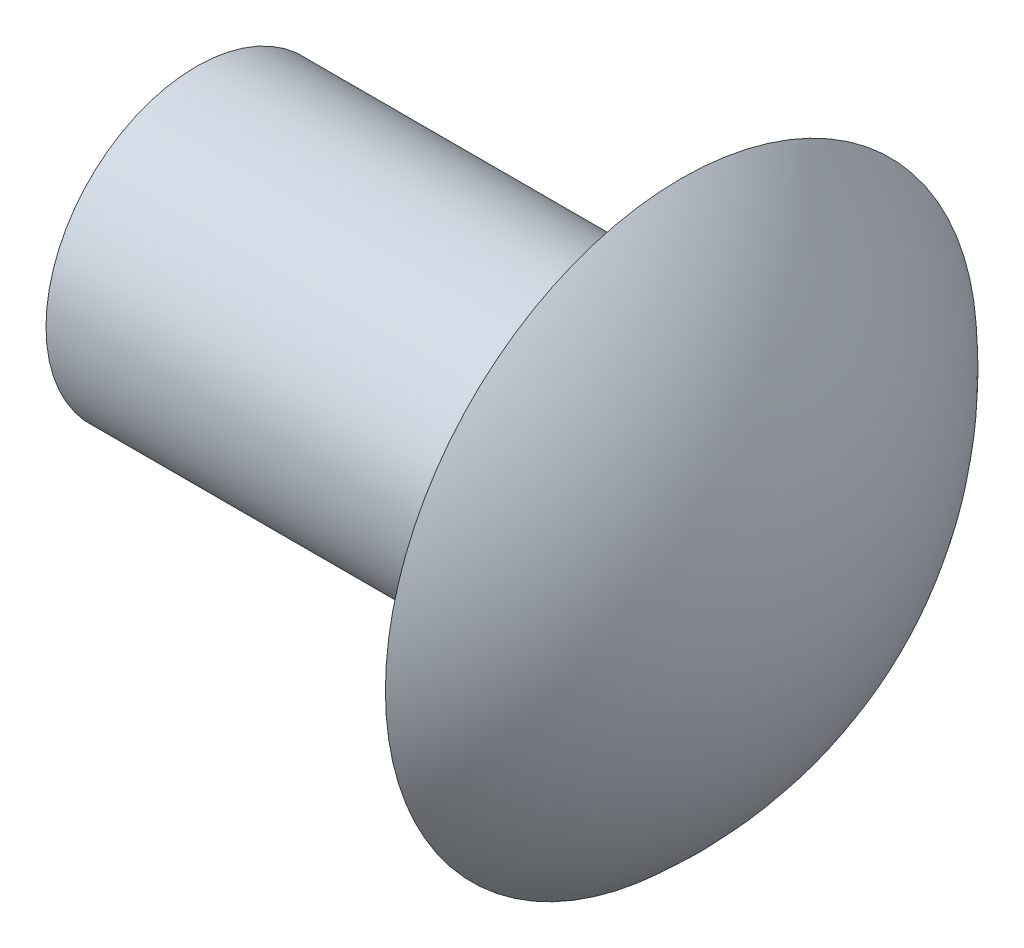
from build123d import *


with BuildPart() as part:
    # Esquisse1 → Révolution1 (revolve)
    with BuildSketch(Plane.XY):
        with BuildLine():
            Line((0, 0), (-5, 0))
            Line((-5, 0), (-5, -1.55))
            Line((-5, -1.55), (0, -1.55))
            Line((0, -1.55), (0, -3.05))
            ThreePointArc((0, -3.05), (1.014205903, -1.672475563), (1.373389252, 0))
            Line((1.373389252, 0), (0, 0))
        make_face()
    revolve(axis=Axis((0, 0, 0), (-1, 0, 0)))


solid = part.part
